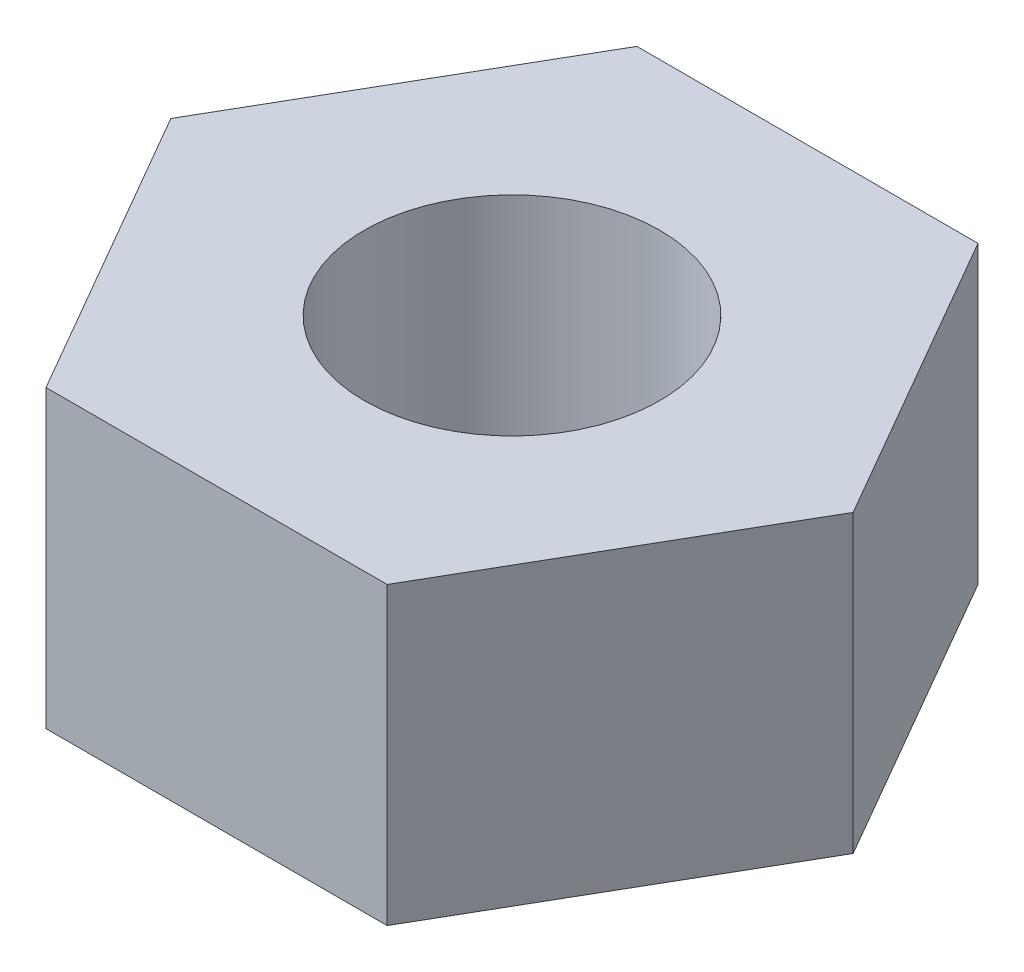
from build123d import *

# Parameters (mm, degrees)
SKETCH1_R           = 1.5
BOSS_EXTRUDE1_DEPTH = 3


with BuildPart() as part:
    # Sketch1 → Boss-Extrude1 (new body)
    with BuildSketch(Plane(origin=(0, 0, 0), x_dir=(1, 0, 0), z_dir=(0, 1, 0))):
        Polygon((3.464101615, 0), (1.732050808, 3), (-1.732050808, 3), (-3.464101615, 0), (-1.732050808, -3), (1.732050808, -3), align=None)
        with Locations(Location((0, 0, 0), (0, 0, 270))):
            Circle(SKETCH1_R, mode=Mode.SUBTRACT)
    extrude(amount=BOSS_EXTRUDE1_DEPTH)


solid = part.part
